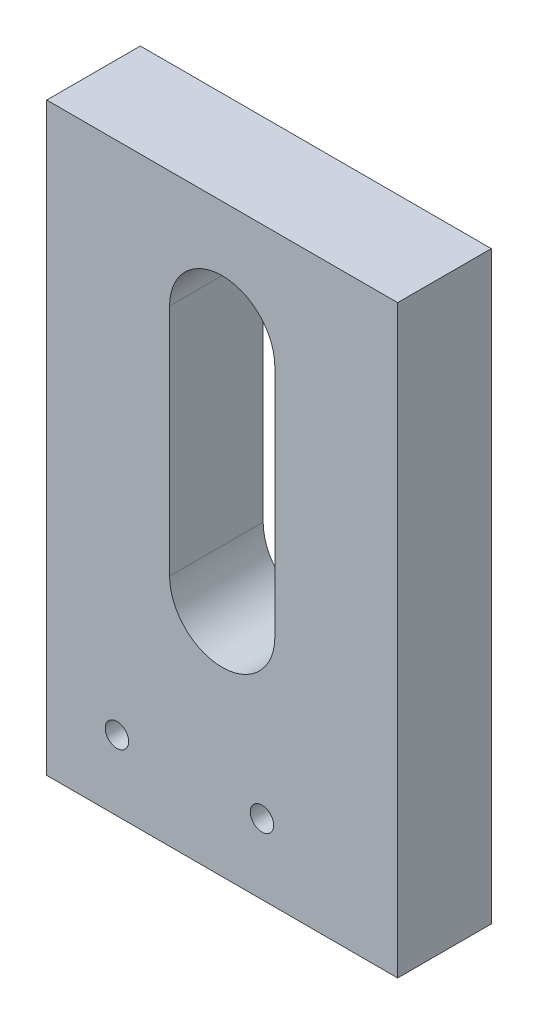
from build123d import *

# Parameters (mm, degrees)
SKETCH1_W           = 15
SKETCH1_H           = 25
SKETCH1_R           = 0.5
BOSS_EXTRUDE1_DEPTH = 4


with BuildPart() as part:
    # Sketch1 → Boss-Extrude1 (new body)
    with BuildSketch(Plane.XY):
        with Locations((7.5, 12.5)):
            Rectangle(SKETCH1_W, SKETCH1_H)
        with Locations((3, 3)):
            Circle(SKETCH1_R, mode=Mode.SUBTRACT)
        with Locations((9.2, 3)):
            Circle(SKETCH1_R, mode=Mode.SUBTRACT)
        with BuildLine():
            Line((9.75, 20), (9.75, 10))
            ThreePointArc((9.75, 10), (7.5, 7.75), (5.25, 10))
            Line((5.25, 10), (5.25, 20))
            ThreePointArc((5.25, 20), (7.5, 22.25), (9.75, 20))
        make_face(mode=Mode.SUBTRACT)
    extrude(amount=BOSS_EXTRUDE1_DEPTH)


solid = part.part
